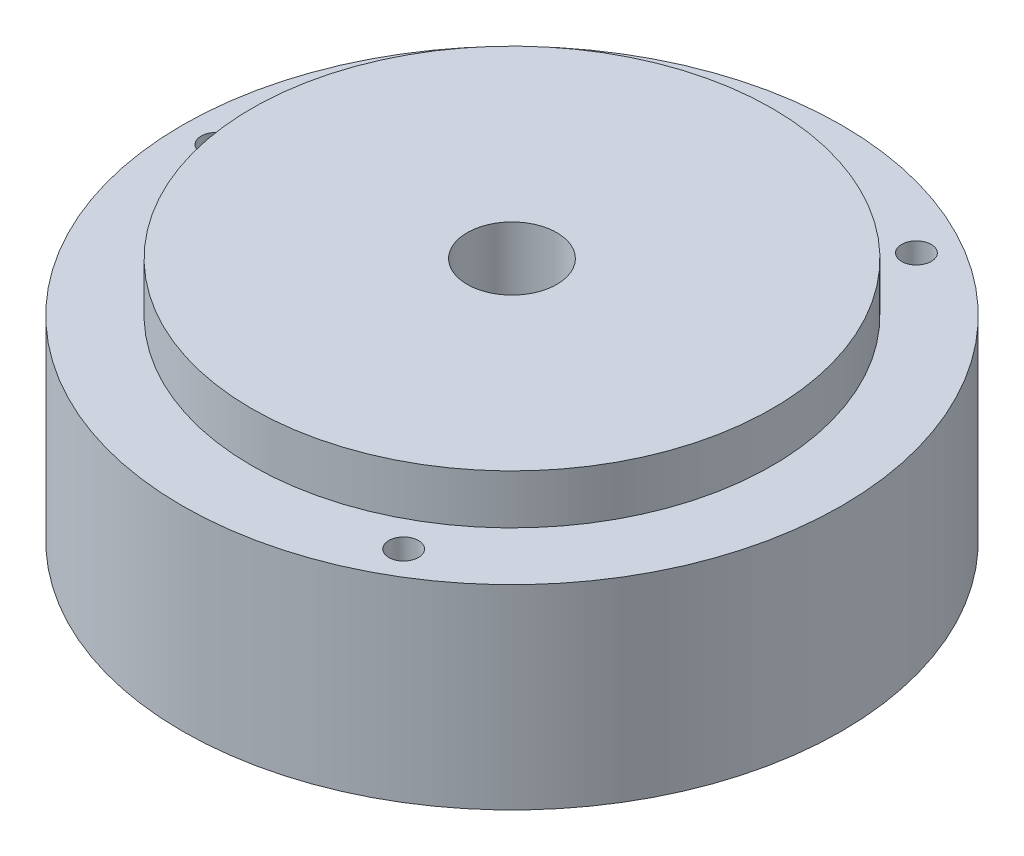
from build123d import *

# Parameters (mm, degrees)
CROQUIS2_R                                           = 10
CORTAR_EXTRUIR1_DEPTH                                = 25
CROQUIS3_R                                           = 20
CORTAR_EXTRUIR2_DEPTH                                = 18
REFRENTADO_PARA_TORNILLO_CON_CABEZA_TRON_D           = 6.6
REFRENTADO_PARA_TORNILLO_CON_CABEZA_TRON_CBORE_D     = 13
REFRENTADO_PARA_TORNILLO_CON_CABEZA_TRON_CBORE_DEPTH = 4.6
CROQUIS6_W                                           = 11.744841144
CROQUIS6_H                                           = 5.153406269
CROQUIS6_W_2                                         = 5.153406269
CROQUIS6_H_2                                         = 11.744841144
CORTAR_EXTRUIR3_DEPTH                                = 10.5


with BuildPart() as part:
    # Croquis1 → Revolución1 (revolve)
    with BuildSketch(Plane.XY, mode=Mode.PRIVATE) as revoluci_n1_sk:
        Polygon((73.5, -19.267048075), (73.5, 24.232951925), (58, 24.232951925), (58, 35.232951925), (0, 35.232951925), (0, -29.767048075), (46.20482663, -29.767048075), (46.20482663, -19.267048075), align=None)
    revolve(revoluci_n1_sk.sketch.rotate(Axis((0, 49.62191358, 0), (0, -1, 0)), 90), axis=Axis((0, 49.62191358, 0), (0, -1, 0)))

    # Croquis2 → Cortar-Extruir1 (cut)
    with BuildSketch(Plane(origin=(0, 35.232951925, 0), x_dir=(1, 0, 0), z_dir=(0, 1, 0))):
        with Locations(Location((0, 0, 0), (0, 0, 270))):
            Circle(CROQUIS2_R)
    extrude(amount=-CORTAR_EXTRUIR1_DEPTH, mode=Mode.SUBTRACT)

    # Croquis3 → Cortar-Extruir2 (cut)
    with BuildSketch(Plane.XZ.offset(29.767048075)):
        with Locations(Location((0, 0, 0), (0, 0, 270))):
            Circle(CROQUIS3_R)
    extrude(amount=-CORTAR_EXTRUIR2_DEPTH, mode=Mode.SUBTRACT)

    # Refrentado para tornillo con cabeza troncocónica de M61 (through all)
    with Locations(Plane(origin=(0, -19.267048075, 0), x_dir=(-1, 0, 0), z_dir=(0, -1, 0))):
        with Locations((66, 0), (-33, -57.15767665), (-33, 57.15767665), (0, 0)):
            CounterBoreHole(REFRENTADO_PARA_TORNILLO_CON_CABEZA_TRON_D / 2, REFRENTADO_PARA_TORNILLO_CON_CABEZA_TRON_CBORE_D / 2, REFRENTADO_PARA_TORNILLO_CON_CABEZA_TRON_CBORE_DEPTH)

    # Croquis6 → Cortar-Extruir3 (cut)
    with BuildSketch(Plane.XZ.offset(29.767048075)):
        with Locations((-0.00913166, -43.646748421)):
            Rectangle(CROQUIS6_W, CROQUIS6_H)
        with Locations((-43.646748421, 0.00913166)):
            Rectangle(CROQUIS6_W_2, CROQUIS6_H_2)
        with Locations((0.00913166, 43.646748421)):
            Rectangle(CROQUIS6_W, CROQUIS6_H)
        with Locations((43.646748421, -0.00913166)):
            Rectangle(CROQUIS6_W_2, CROQUIS6_H_2)
    extrude(amount=-CORTAR_EXTRUIR3_DEPTH, mode=Mode.SUBTRACT)


solid = part.part
